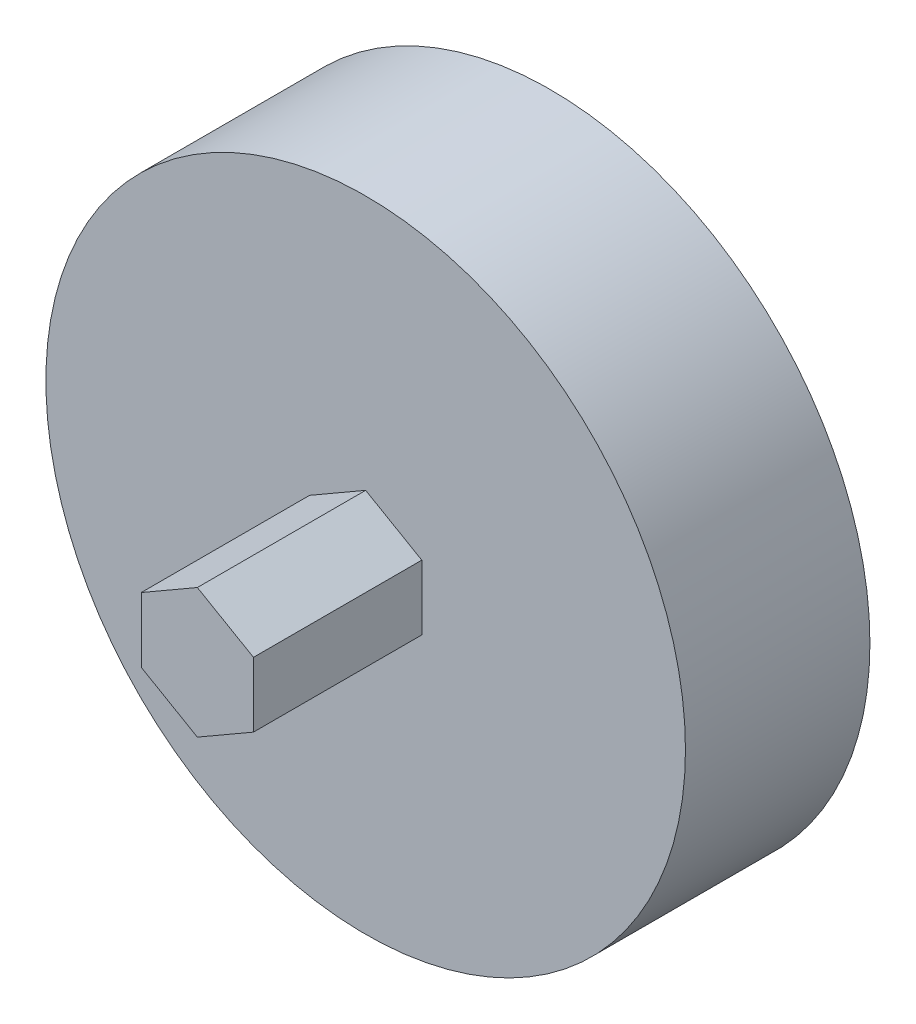
from build123d import *

# Parameters (mm, degrees)
SKETCH2_R           = 36.195
BOSS_EXTRUDE1_DEPTH = 20.8788
BOSS_EXTRUDE2_DEPTH = 19.05


with BuildPart() as part:
    # Sketch2 → Boss-Extrude1 (new body)
    with BuildSketch(Plane.XY):
        Circle(SKETCH2_R)
    extrude(amount=BOSS_EXTRUDE1_DEPTH)

    # Sketch3 → Boss-Extrude2 (add)
    with BuildSketch(Plane.XY.offset(20.8788)):
        Polygon((6.35, -3.666174209), (6.35, 3.666174209), (0, 7.332348419), (-6.35, 3.666174209), (-6.35, -3.666174209), (0, -7.332348419), align=None)
    extrude(amount=BOSS_EXTRUDE2_DEPTH)


solid = part.part
